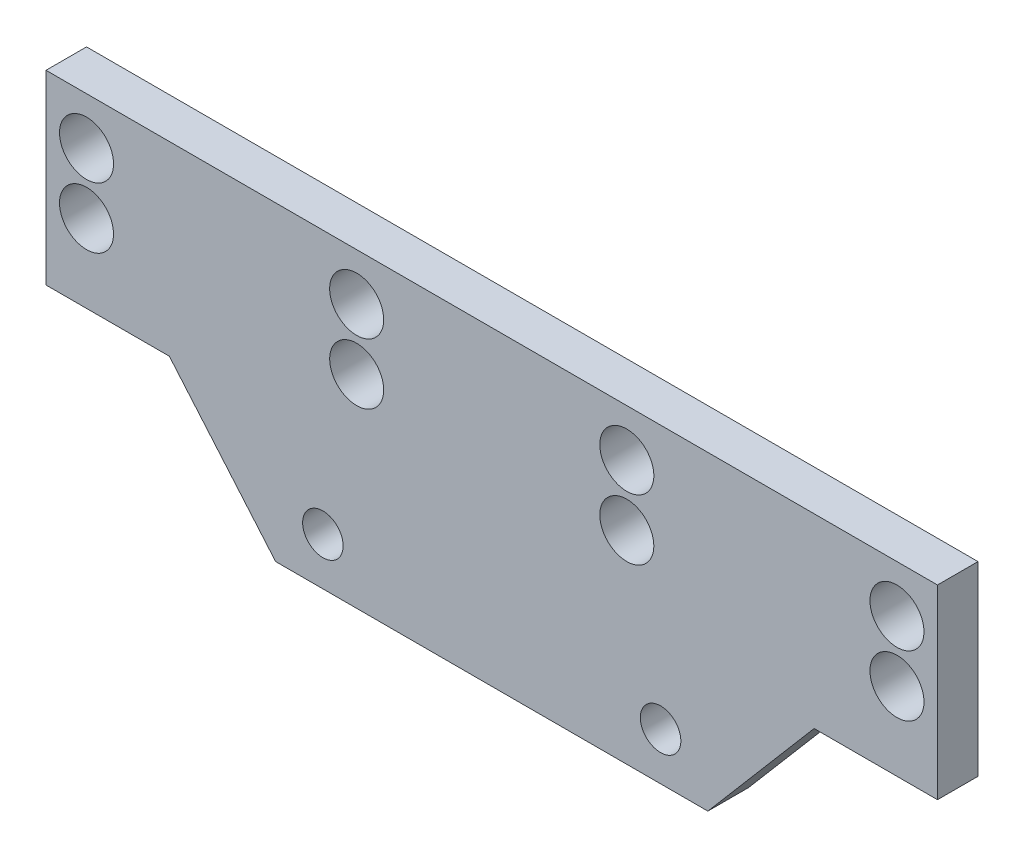
from build123d import *

# Parameters (mm, degrees)
SKETCH_1_W          = 66
SKETCH_1_H          = 23
SKETCH_1_R          = 2
SKETCH_1_R_2        = 1.5
EXTRUDE_1_DEPTH     = 3
CUT_EXTRUDE_1_DEPTH = 46.311168738


with BuildPart() as part:
    # 草图1 → 凸台-拉伸1 (new body)
    with BuildSketch(Plane.XY):
        with Locations((4.349837666, 13.977276909)):
            Rectangle(SKETCH_1_W, SKETCH_1_H)
        with Locations((-5.650162334, 21.977276909)):
            Circle(SKETCH_1_R, mode=Mode.SUBTRACT)
        with Locations((-25.650162334, 21.977276909)):
            Circle(SKETCH_1_R, mode=Mode.SUBTRACT)
        with Locations(Location((14.349837666, 21.977276909, 0), (0, 0, 180))):
            Circle(SKETCH_1_R, mode=Mode.SUBTRACT)
        with Locations(Location((34.349837666, 21.977276909, 0), (0, 0, 180))):
            Circle(SKETCH_1_R, mode=Mode.SUBTRACT)
        with Locations((34.349837666, 17.477276909)):
            Circle(SKETCH_1_R, mode=Mode.SUBTRACT)
        with Locations((14.349837666, 17.477276909)):
            Circle(SKETCH_1_R, mode=Mode.SUBTRACT)
        with Locations(Location((-5.650162334, 17.477276909, 0), (0, 0, 180))):
            Circle(SKETCH_1_R, mode=Mode.SUBTRACT)
        with Locations(Location((-25.650162334, 17.477276909, 0), (0, 0, 180))):
            Circle(SKETCH_1_R, mode=Mode.SUBTRACT)
        with Locations((-8.150162334, 5.977276909)):
            Circle(SKETCH_1_R_2, mode=Mode.SUBTRACT)
        with Locations(Location((16.849837666, 5.977276909, 0), (0, 0, 180))):
            Circle(SKETCH_1_R_2, mode=Mode.SUBTRACT)
    extrude(amount=EXTRUDE_1_DEPTH)

    # 草图2 → 切除-拉伸1 (cut, through all)
    with BuildSketch(Plane.XY.offset(3)):
        Polygon((-28.650162334, 11.707841664), (-19.517537848, 11.707841664), (-11.650162334, 2.477276909), (-28.650162334, 2.477276909), align=None)
        Polygon((20.349837666, 2.477276909), (37.349837666, 2.477276909), (37.349837666, 11.707841664), (28.217213181, 11.707841664), align=None)
    extrude(amount=-CUT_EXTRUDE_1_DEPTH, mode=Mode.SUBTRACT)


solid = part.part
